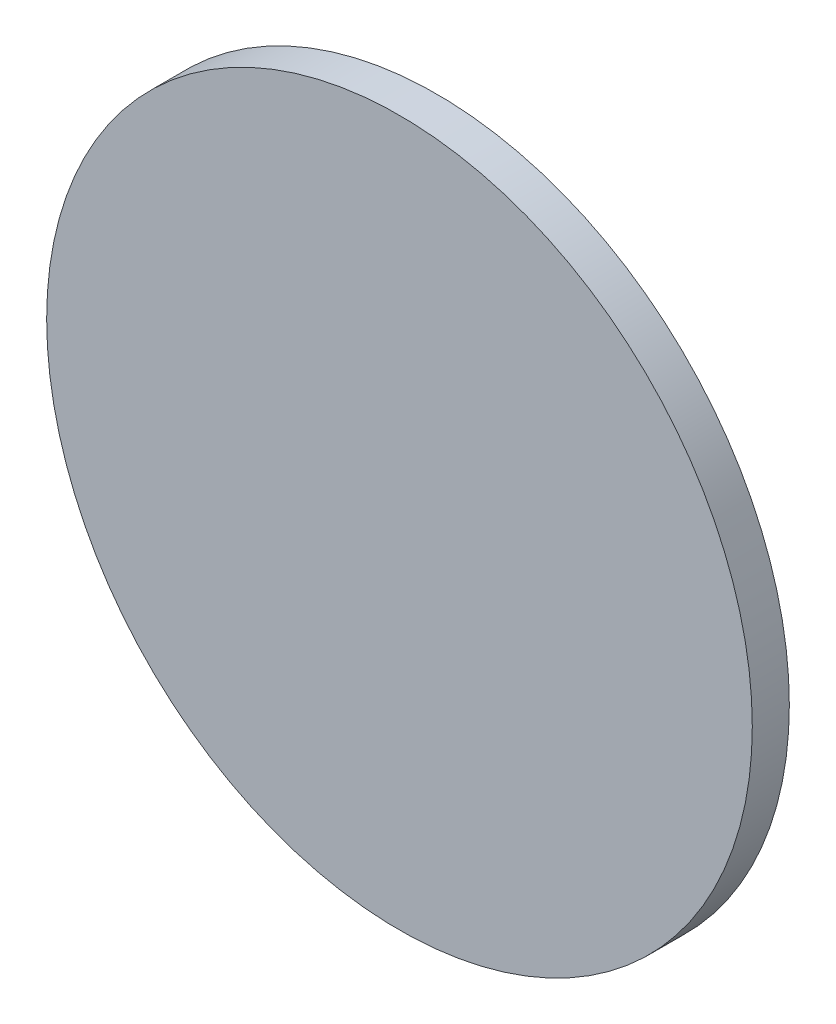
from build123d import *

# Parameters (mm, degrees)
SKETCH1_R           = 9.525
BOSS_EXTRUDE1_DEPTH = 1


with BuildPart() as part:
    # Sketch1 → Boss-Extrude1 (new body)
    with BuildSketch(Plane.XY):
        Circle(SKETCH1_R)
    extrude(amount=BOSS_EXTRUDE1_DEPTH)


solid = part.part
